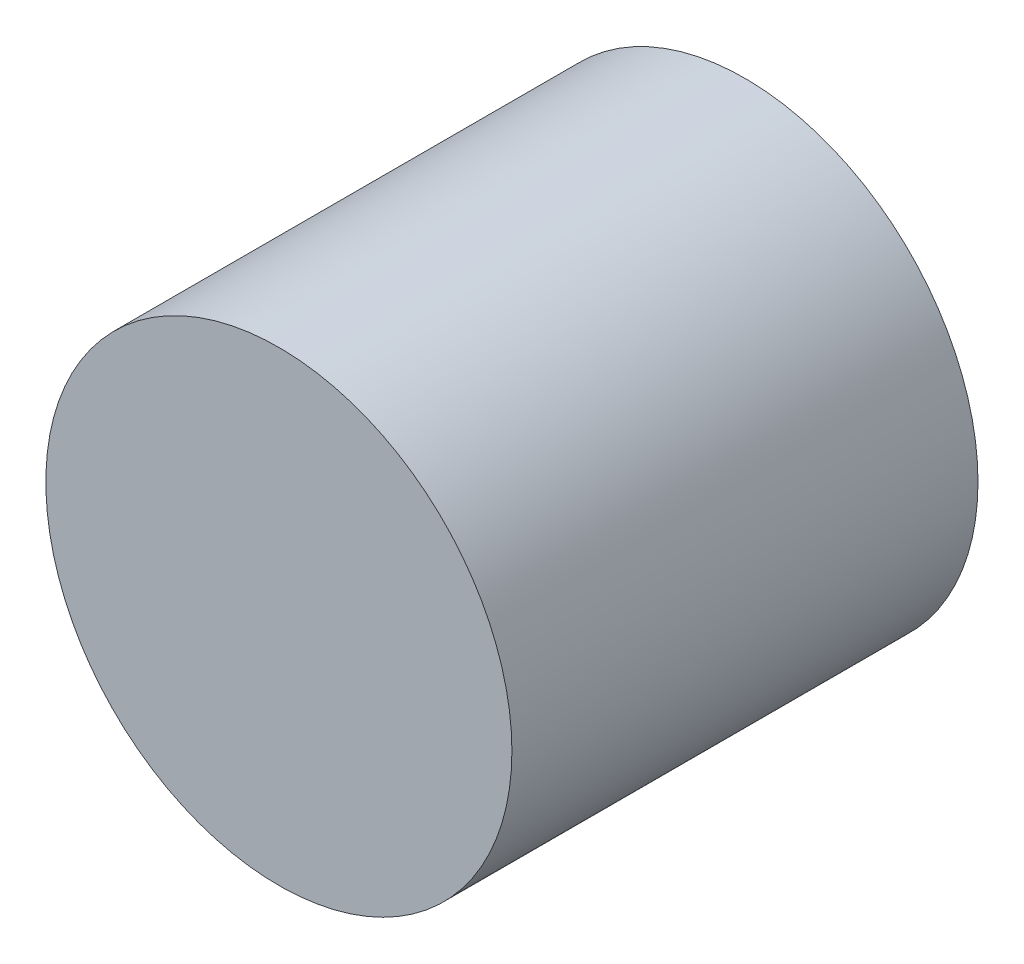
from build123d import *

# Parameters (mm, degrees)
SKETCH1_R           = 55
BOSS_EXTRUDE1_DEPTH = 110


with BuildPart() as part:
    # Sketch1 → Boss-Extrude1 (new body)
    with BuildSketch(Plane.XY):
        with Locations((0, 425.078577337)):
            Circle(SKETCH1_R)
    extrude(amount=BOSS_EXTRUDE1_DEPTH)


solid = part.part
